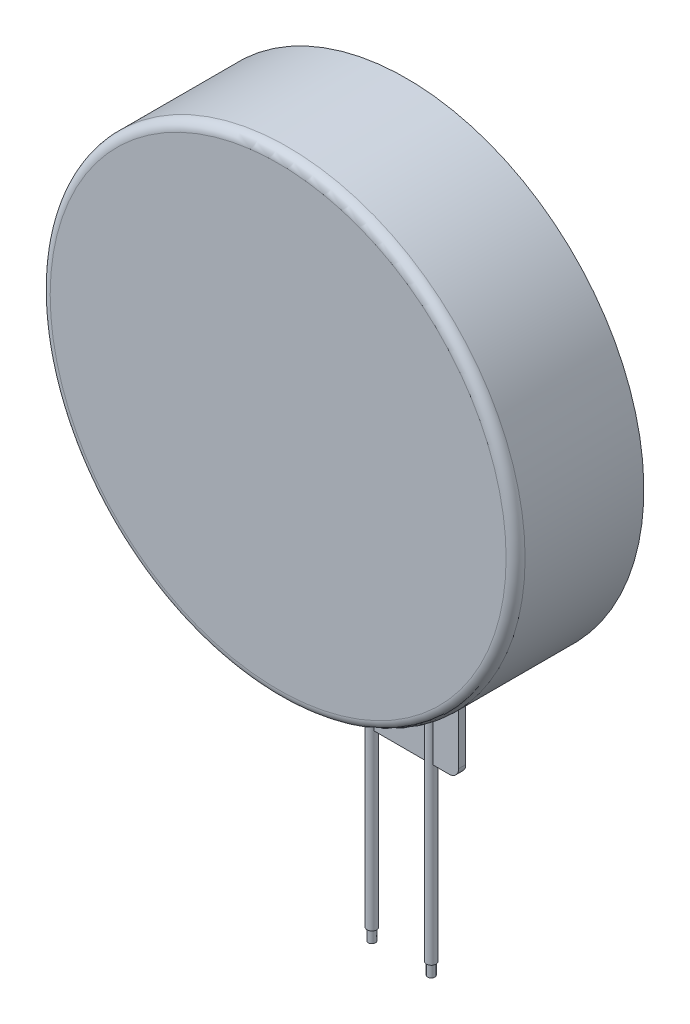
from build123d import *

# Parameters (mm, degrees)
SKETCH1_R                  = 5
BOSS_EXTRUDE1_DEPTH        = 2.7
BOSS_EXTRUDE2_DEPTH        = 0.15
BOSS_EXTRUDE3_DEPTH        = 3.9
BOSS_EXTRUDE3_DEPTH_BACK   = 2.2
SKETCH4_R                  = 0.101
BOSS_EXTRUDE3_2_DEPTH      = 3.9
BOSS_EXTRUDE3_2_DEPTH_BACK = 2.2
FILLET1_R                  = 0.2
FILLET2_R                  = 0.2
SKETCH5_OUTSIDE_W          = 15.81
SKETCH5_OUTSIDE_H          = 8.51
SKETCH5_OUTSIDE_R          = 0.075
CUT_EXTRUDE4_DEPTH         = 0.25


with BuildPart() as part:
    # Sketch1 → Boss-Extrude1 (new body)
    with BuildSketch(Plane.XY):
        with Locations(Location((0, 0, 0), (0, 0, 180))):
            Circle(SKETCH1_R)
    extrude(amount=BOSS_EXTRUDE1_DEPTH)

    # Sketch3 → Boss-Extrude2 (add)
    with BuildSketch(Plane(origin=(0, 0, 0), x_dir=(-1, 0, 0), z_dir=(0, 0, -1))):
        Polygon((1.25, -4.841229183), (1.25, -7.091229183), (-1.25, -7.091229183), (-1.25, -4.841229183), (-1.25, -4.179733262), (1.25, -4.179733262), align=None)
    extrude(amount=-BOSS_EXTRUDE2_DEPTH)

    # Fillet1
    fillet1_edges = [part.edges().sort_by_distance(p)[0] for p in [
        (1.25, -7.091229183, 0.075),
        (-1.25, -7.091229183, 0.075),
    ]]
    fillet(fillet1_edges, radius=FILLET1_R)

    # Fillet2
    fillet2_edges = [part.edges().sort_by_distance(p)[0] for p in [
        (5, 0, 2.7),
    ]]
    fillet(fillet2_edges, radius=FILLET2_R)


with BuildPart() as body_2:
    # Sketch4 → Boss-Extrude3 (new, two sides: drawn at the far end of the back side and taken through both)
    with BuildSketch(Plane.XZ.offset(7.091229183).offset(-BOSS_EXTRUDE3_DEPTH_BACK)):
        with Locations(Location((-0.625, 0.101, 0), (0, 0, 270))):
            Circle(SKETCH4_R)
    extrude(amount=BOSS_EXTRUDE3_DEPTH + BOSS_EXTRUDE3_DEPTH_BACK)


with BuildPart() as body_3:
    # Sketch4 → Boss-Extrude3 2 (new, two sides: drawn at the far end of the back side and taken through both)
    with BuildSketch(Plane.XZ.offset(7.091229183).offset(-BOSS_EXTRUDE3_2_DEPTH_BACK)):
        with Locations(Location((0.625, 0.101, 0), (0, 0, 270))):
            Circle(SKETCH4_R)
    extrude(amount=BOSS_EXTRUDE3_2_DEPTH + BOSS_EXTRUDE3_2_DEPTH_BACK)


with BuildPart() as cut_extrude4_tool:
    # Sketch5 outside → Cut-Extrude4 (new body)
    with BuildSketch(Plane.XZ.offset(10.991229183)):
        with Locations((0, 1.35)):
            Rectangle(SKETCH5_OUTSIDE_W, SKETCH5_OUTSIDE_H)
        with Locations(Location((-0.625, 0.101, 0), (0, 0, 270))):
            Circle(SKETCH5_OUTSIDE_R, mode=Mode.SUBTRACT)
        with Locations(Location((0.625, 0.101, 0), (0, 0, 270))):
            Circle(SKETCH5_OUTSIDE_R, mode=Mode.SUBTRACT)
    extrude(amount=-CUT_EXTRUDE4_DEPTH)


with BuildPart() as body_2_1:
    add(body_2.part)

    # Cut-Extrude4: cut by cut_extrude4_tool
    add(cut_extrude4_tool.part, mode=Mode.SUBTRACT)


with BuildPart() as body_3_1:
    add(body_3.part)

    # Cut-Extrude4: cut by cut_extrude4_tool
    add(cut_extrude4_tool.part, mode=Mode.SUBTRACT)


solid = Compound([part.part, body_2_1.part, body_3_1.part])
